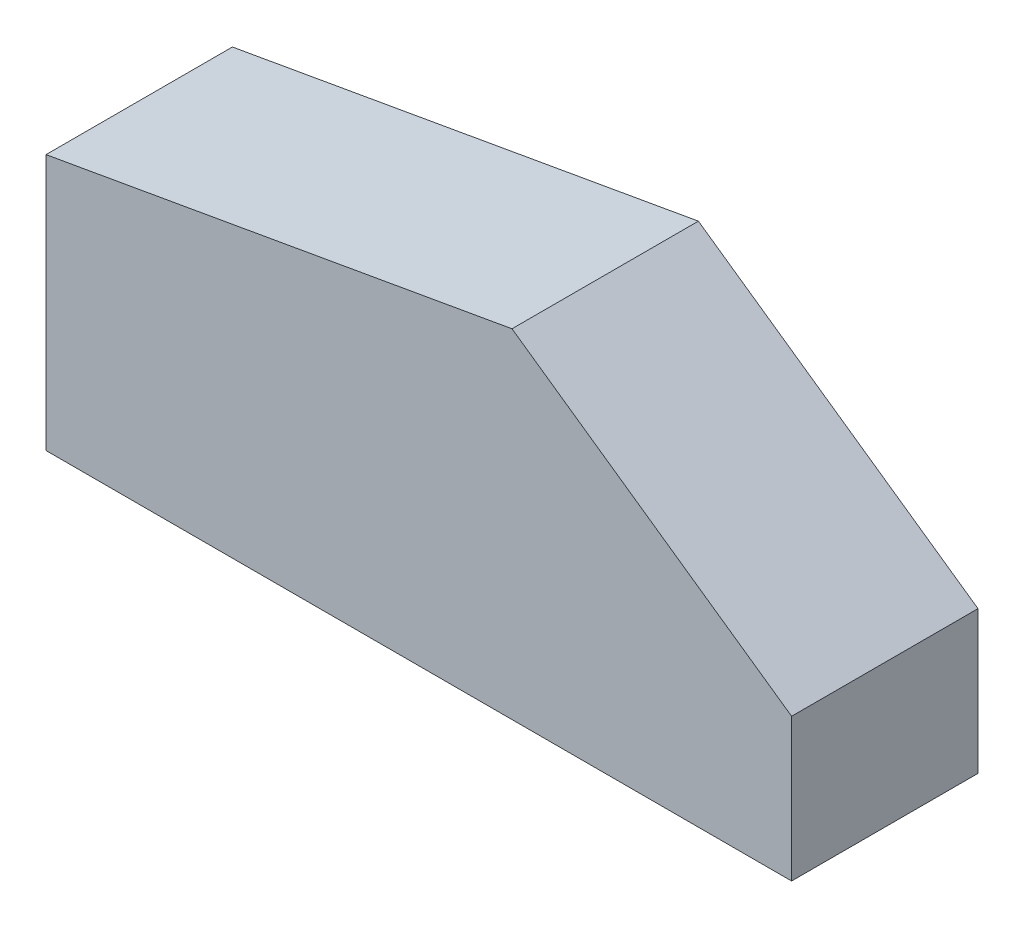
from build123d import *

# Parameters (mm, degrees)
BOSS_EXTRUDE1_DEPTH = 10


with BuildPart() as part:
    # Sketch1 → Boss-Extrude1 (new body)
    with BuildSketch(Plane.XY):
        Polygon((0, 0), (40, 0), (40, 7.655061445), (25, 18.158174518), (0, 13.75), align=None)
    extrude(amount=BOSS_EXTRUDE1_DEPTH)


solid = part.part
